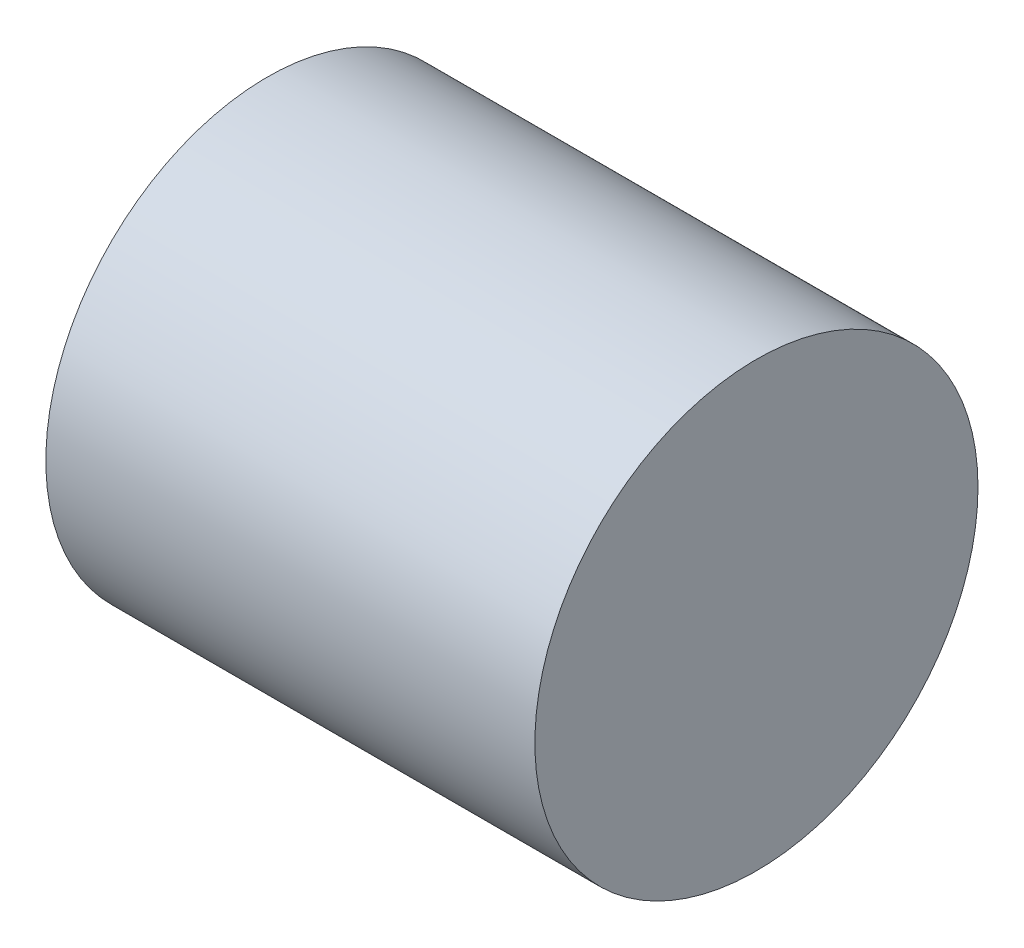
from build123d import *

# Parameters (mm, degrees)
CURVESKETCH_R   = 9.32933
CURVEBOSS_DEPTH = 20.59193


with BuildPart() as part:
    # CurveSketch → CurveBoss (new body)
    with BuildSketch(Plane(origin=(0, 0, 0), x_dir=(0, 0, -1), z_dir=(1, 0, 0))):
        with Locations((9.173, -2.419)):
            Circle(CURVESKETCH_R)
    extrude(amount=-CURVEBOSS_DEPTH)


solid = part.part
